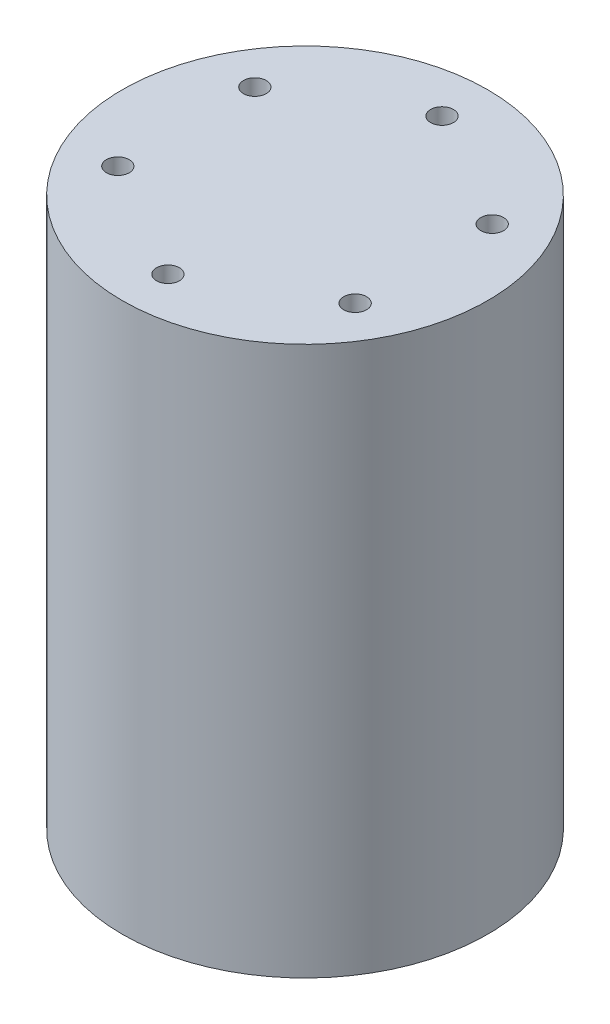
from build123d import *

# Parameters (mm, degrees)
SKETCH1_R                            = 40
BOSS_EXTRUDE1_DEPTH                  = 60.075
TAP_DRILL_FOR_M6X1_0_TAP1_AT_2_COUNT = 2
TAP_DRILL_FOR_M6X1_0_TAP1_AT_2_PITCH = 30
TAP_DRILL_FOR_M6X1_0_TAP1_AT_3_COUNT = 2
TAP_DRILL_FOR_M6X1_0_TAP1_AT_3_PITCH = 51.961524227
TAP_DRILL_FOR_M6X1_0_TAP1_AT_4_COUNT = 2
TAP_DRILL_FOR_M6X1_0_TAP1_AT_4_PITCH = 60
TAP_DRILL_FOR_M6X1_0_TAP1_AT_5_COUNT = 2
TAP_DRILL_FOR_M6X1_0_TAP1_AT_5_PITCH = 51.961524227
TAP_DRILL_FOR_M6X1_0_TAP1_AT_6_COUNT = 2
TAP_DRILL_FOR_M6X1_0_TAP1_AT_6_PITCH = 30


with BuildPart() as part:
    # Sketch1 → Boss-Extrude1 (new body)
    with BuildSketch(Plane(origin=(0, 0, 0), x_dir=(1, 0, 0), z_dir=(0, 1, 0))):
        with Locations(Location((0, 0, 0), (0, 0, 270))):
            Circle(SKETCH1_R)
    boss_extrude1 = extrude(amount=BOSS_EXTRUDE1_DEPTH)

    # Sketch4 → Tap Drill for M6x1.0 Tap1 (revolve, cut)
    with BuildSketch(Plane(origin=(25.980762114, 0, 15), x_dir=(0, 0, -1), z_dir=(1, 0, 0))):
        Polygon((0, 0), (0, 11.502151548), (2.5, 10), (2.5, 0), align=None)
    tap_drill_for_m6x1_0_tap1 = revolve(axis=Axis((25.980762114, -6.35, 15), (0, 1, 0)), mode=Mode.SUBTRACT)

    # Tap Drill for M6x1.0 Tap1 at 2: Tap Drill for M6x1.0 Tap1 ×2
    with Locations(*[(0, 0, -i * TAP_DRILL_FOR_M6X1_0_TAP1_AT_2_PITCH) for i in range(1, TAP_DRILL_FOR_M6X1_0_TAP1_AT_2_COUNT)]):
        add(tap_drill_for_m6x1_0_tap1, mode=Mode.SUBTRACT)

    # Tap Drill for M6x1.0 Tap1 at 3: Tap Drill for M6x1.0 Tap1 ×2
    with Locations(*[Vector(-0.5000000000000001, 0, -0.8660254037844386) * (i * TAP_DRILL_FOR_M6X1_0_TAP1_AT_3_PITCH) for i in range(1, TAP_DRILL_FOR_M6X1_0_TAP1_AT_3_COUNT)]):
        add(tap_drill_for_m6x1_0_tap1, mode=Mode.SUBTRACT)

    # Tap Drill for M6x1.0 Tap1 at 4: Tap Drill for M6x1.0 Tap1 ×2
    with Locations(*[Vector(-0.8660254037844389, 0, -0.4999999999999995) * (i * TAP_DRILL_FOR_M6X1_0_TAP1_AT_4_PITCH) for i in range(1, TAP_DRILL_FOR_M6X1_0_TAP1_AT_4_COUNT)]):
        add(tap_drill_for_m6x1_0_tap1, mode=Mode.SUBTRACT)

    # Tap Drill for M6x1.0 Tap1 at 5: Tap Drill for M6x1.0 Tap1 ×2
    with Locations(*[(-i * TAP_DRILL_FOR_M6X1_0_TAP1_AT_5_PITCH, 0, 0) for i in range(1, TAP_DRILL_FOR_M6X1_0_TAP1_AT_5_COUNT)]):
        add(tap_drill_for_m6x1_0_tap1, mode=Mode.SUBTRACT)

    # Tap Drill for M6x1.0 Tap1 at 6: Tap Drill for M6x1.0 Tap1 ×2
    with Locations(*[Vector(-0.8660254037844386, 0, 0.5000000000000001) * (i * TAP_DRILL_FOR_M6X1_0_TAP1_AT_6_PITCH) for i in range(1, TAP_DRILL_FOR_M6X1_0_TAP1_AT_6_COUNT)]):
        add(tap_drill_for_m6x1_0_tap1, mode=Mode.SUBTRACT)

    # Mirror1: Boss-Extrude1, Tap Drill for M6x1.0 Tap1 across plane
    add(boss_extrude1.mirror(Plane.ZX.offset(60.075)))
    add(tap_drill_for_m6x1_0_tap1.mirror(Plane.ZX.offset(60.075)), mode=Mode.SUBTRACT)

    # Mirror1 copy 1 sketch → Mirror1 copy 1 (revolve, cut)
    with BuildSketch(Plane(origin=(25.980762114, 120.15, -15), x_dir=(0, 0, -1), z_dir=(1, 0, 0))):
        Polygon((0, 0), (0, -11.502151548), (2.5, -10), (2.5, 0), align=None)
    revolve(axis=Axis((25.980762114, 126.5, -15), (0, 1, 0)), mode=Mode.SUBTRACT)

    # Mirror1 copy 2 sketch → Mirror1 copy 2 (revolve, cut)
    with BuildSketch(Plane(origin=(0, 120.15, -30), x_dir=(0, 0, -1), z_dir=(1, 0, 0))):
        Polygon((0, 0), (0, -11.502151548), (2.5, -10), (2.5, 0), align=None)
    revolve(axis=Axis((0, 126.5, -30), (0, 1, 0)), mode=Mode.SUBTRACT)

    # Mirror1 copy 3 sketch → Mirror1 copy 3 (revolve, cut)
    with BuildSketch(Plane(origin=(-25.980762114, 120.15, -15), x_dir=(0, 0, -1), z_dir=(1, 0, 0))):
        Polygon((0, 0), (0, -11.502151548), (2.5, -10), (2.5, 0), align=None)
    revolve(axis=Axis((-25.980762114, 126.5, -15), (0, 1, 0)), mode=Mode.SUBTRACT)

    # Mirror1 copy 4 sketch → Mirror1 copy 4 (revolve, cut)
    with BuildSketch(Plane(origin=(-25.980762114, 120.15, 15), x_dir=(0, 0, -1), z_dir=(1, 0, 0))):
        Polygon((0, 0), (0, -11.502151548), (2.5, -10), (2.5, 0), align=None)
    revolve(axis=Axis((-25.980762114, 126.5, 15), (0, 1, 0)), mode=Mode.SUBTRACT)

    # Mirror1 copy 5 sketch → Mirror1 copy 5 (revolve, cut)
    with BuildSketch(Plane(origin=(0, 120.15, 30), x_dir=(0, 0, -1), z_dir=(1, 0, 0))):
        Polygon((0, 0), (0, -11.502151548), (2.5, -10), (2.5, 0), align=None)
    revolve(axis=Axis((0, 126.5, 30), (0, 1, 0)), mode=Mode.SUBTRACT)


solid = part.part
